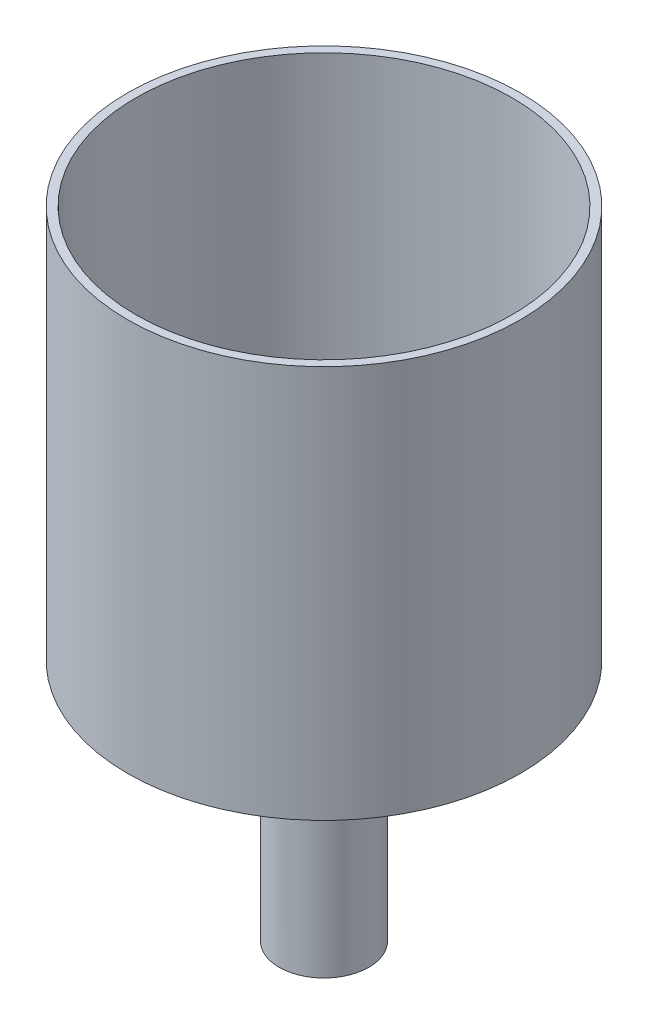
from build123d import *

# Parameters (mm, degrees)
SKETCH1_R           = 8
BOSS_EXTRUDE1_DEPTH = 45
CHAMFER1_SIZE       = 3
CHAMFER1_SIZE2      = 1.595128295
SKETCH2_R           = 35
BOSS_EXTRUDE2_DEPTH = 70
SHELL1_T            = -1.5
SKETCH3_R           = 33.5
BOSS_EXTRUDE3_DEPTH = 2


with BuildPart() as part:
    # Sketch1 → Boss-Extrude1 (new body)
    with BuildSketch(Plane(origin=(0, 0, 0), x_dir=(1, 0, 0), z_dir=(0, 1, 0))):
        with Locations(Location((0, 0, 0), (0, 0, 90))):
            Circle(SKETCH1_R)
    extrude(amount=BOSS_EXTRUDE1_DEPTH)

    # Chamfer1
    chamfer1_edges = [part.edges().sort_by_distance(p)[0] for p in [
        (0, 0, 8),
    ]]
    chamfer1_side = [part.faces().sort_by_distance(p)[0] for p in [
        (0, 0, 0),
    ]]
    chamfer(chamfer1_edges, length=CHAMFER1_SIZE, length2=CHAMFER1_SIZE2, reference=chamfer1_side[0])

    # Sketch2 → Boss-Extrude2 (add)
    with BuildSketch(Plane(origin=(0, 45, 0), x_dir=(1, 0, 0), z_dir=(0, 1, 0))):
        with Locations(Location((0, 0, 0), (0, 0, 270))):
            Circle(SKETCH2_R)
    extrude(amount=BOSS_EXTRUDE2_DEPTH)

    # Shell1
    shell1_openings = [part.faces().sort_by_distance(p)[0] for p in [
        (0, 115, 0),
    ]]
    offset(amount=SHELL1_T, openings=shell1_openings, kind=Kind.INTERSECTION)

    # Sketch3 → Boss-Extrude3 (add)
    with BuildSketch(Plane(origin=(0, 46.5, 0), x_dir=(1, 0, 0), z_dir=(0, 1, 0))):
        with Locations(Location((0, 0, 0), (0, 0, 270))):
            Circle(SKETCH3_R)
    extrude(amount=BOSS_EXTRUDE3_DEPTH)


solid = part.part
